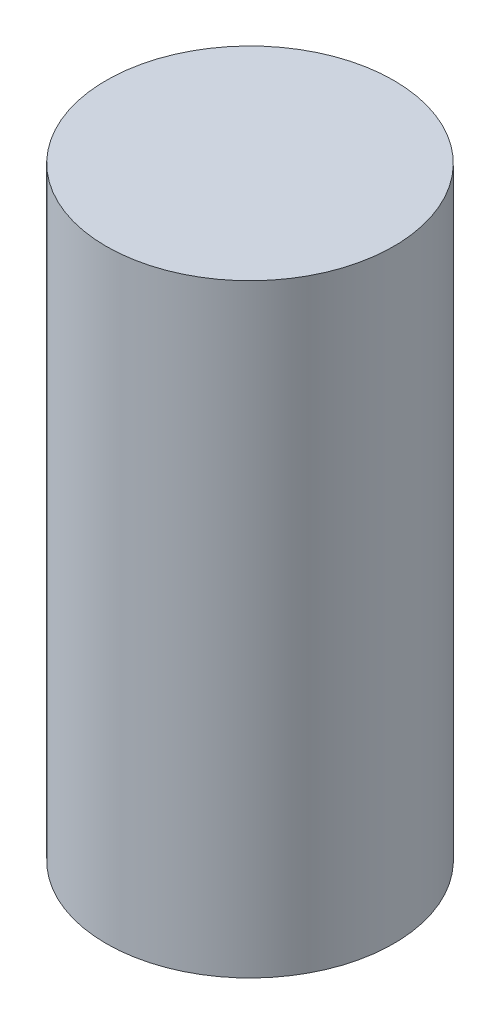
from build123d import *

# Parameters (mm, degrees)
SKETCH1_R           = 50
BOSS_EXTRUDE1_DEPTH = 210


with BuildPart() as part:
    # Sketch1 → Boss-Extrude1 (new body)
    with BuildSketch(Plane(origin=(0, 0, 0), x_dir=(1, 0, 0), z_dir=(0, 1, 0))):
        with Locations(Location((0, 0, 0), (0, 0, 270))):
            Circle(SKETCH1_R)
    extrude(amount=BOSS_EXTRUDE1_DEPTH)


solid = part.part
